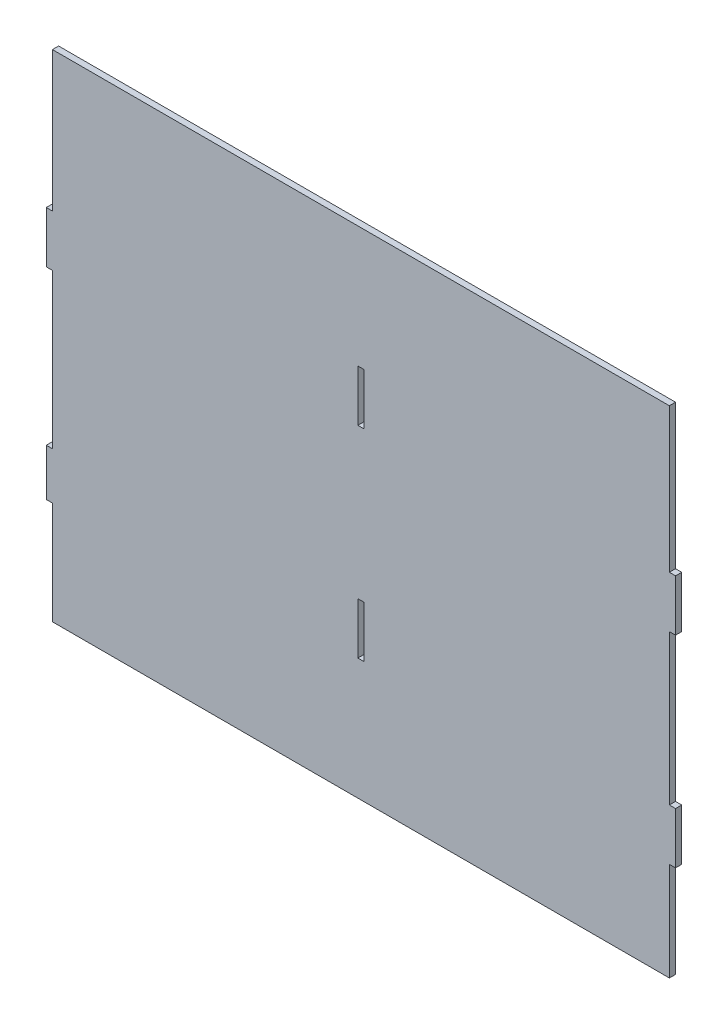
from build123d import *

# Parameters (mm, degrees)
SKETCH1_W           = 6
SKETCH1_H           = 50
BOSS_EXTRUDE1_DEPTH = 6


with BuildPart() as part:
    # Sketch1 → Boss-Extrude1 (new body)
    with BuildSketch(Plane.XY):
        Polygon((-300, 241), (300, 241), (300, 100.732281984), (306, 100.732281984), (306, 50.732281984), (300, 50.732281984), (300, -95.267718016), (306, -95.267718016), (306, -145.267718016), (300, -145.267718016), (300, -241), (-300, -241), (-300, -141), (-306, -141), (-306, -95.267718016), (-300, -95.267718016), (-300, 55), (-306, 55), (-306, 105), (-300, 105), align=None)
        with Locations((0, 98)):
            Rectangle(SKETCH1_W, SKETCH1_H, mode=Mode.SUBTRACT)
        with Locations((0, -98)):
            Rectangle(SKETCH1_W, SKETCH1_H, mode=Mode.SUBTRACT)
    extrude(amount=BOSS_EXTRUDE1_DEPTH)


solid = part.part
